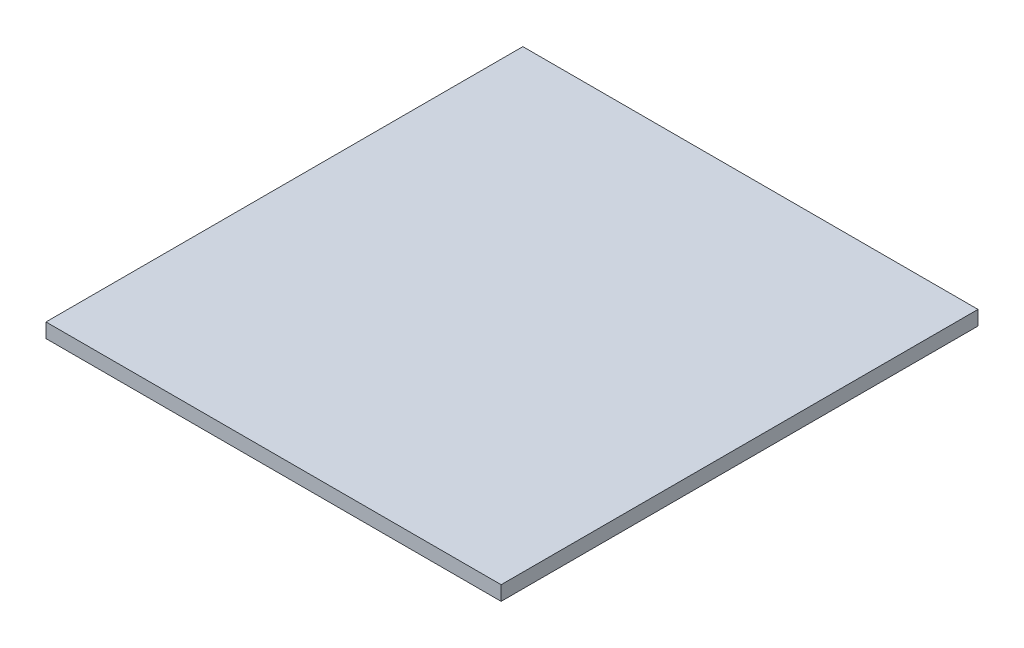
from build123d import *

# Parameters (mm, degrees)
SKETCH1_W           = 200
SKETCH1_H           = 209.55
BOSS_EXTRUDE1_DEPTH = 3.175


with BuildPart() as part:
    # Sketch1 → Boss-Extrude1 (new, symmetric)
    with BuildSketch(Plane(origin=(0, 0, 0), x_dir=(1, 0, 0), z_dir=(0, 1, 0))):
        Rectangle(SKETCH1_W, SKETCH1_H)
    extrude(amount=BOSS_EXTRUDE1_DEPTH, both=True)


solid = part.part
